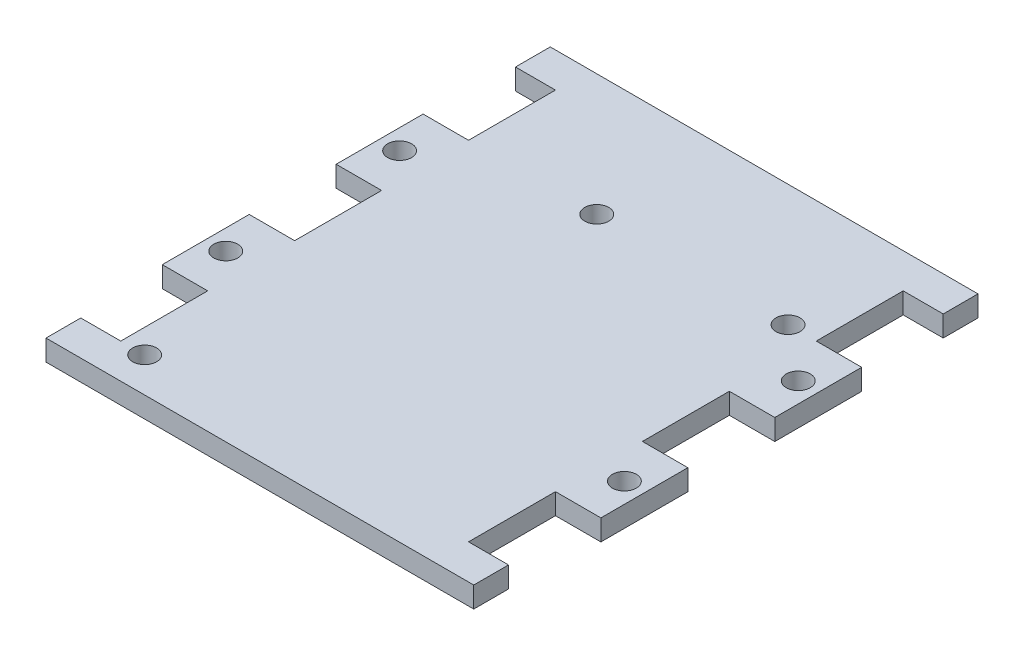
from build123d import *

# Parameters (mm, degrees)
SKETCH1_R           = 1.7526
BOSS_EXTRUDE1_DEPTH = 3.048
SKETCH2_R           = 1.7526
CUT_EXTRUDE1_DEPTH  = 49.908368221


with BuildPart() as part:
    # Sketch1 → Boss-Extrude1 (new body)
    with BuildSketch(Plane(origin=(0, 0, 0), x_dir=(1, 0, 0), z_dir=(0, 1, 0))):
        Polygon((31.242, -36.83), (-31.242, -36.83), (-31.242, -31.75), (-25.4, -31.75), (-25.4, -19.05), (-31.242, -19.05), (-32.03575, -19.05), (-32.03575, -6.35), (-31.242, -6.35), (-25.4, -6.35), (-25.4, 6.35), (-31.242, 6.35), (-32.03575, 6.35), (-32.03575, 19.05), (-31.242, 19.05), (-25.4, 19.05), (-25.4, 31.75), (-31.242, 31.75), (-31.242, 36.83), (31.242, 36.83), (31.242, 31.75), (25.4, 31.75), (25.4, 19.05), (31.242, 19.05), (32.03575, 19.05), (32.03575, 6.35), (31.242, 6.35), (25.4, 6.35), (25.4, -6.35), (31.242, -6.35), (32.03575, -6.35), (32.03575, -19.05), (31.242, -19.05), (25.4, -19.05), (25.4, -31.75), (31.242, -31.75), align=None)
        with Locations(Location((-29.11475, 12.7, 0), (0, 0, 90))):
            Circle(SKETCH1_R, mode=Mode.SUBTRACT)
        with Locations(Location((-29.11475, -12.7, 0), (0, 0, 90))):
            Circle(SKETCH1_R, mode=Mode.SUBTRACT)
        with Locations(Location((29.11475, -12.7, 0), (0, 0, 90))):
            Circle(SKETCH1_R, mode=Mode.SUBTRACT)
        with Locations(Location((29.11475, 12.7, 0), (0, 0, 90))):
            Circle(SKETCH1_R, mode=Mode.SUBTRACT)
    extrude(amount=BOSS_EXTRUDE1_DEPTH)

    # Sketch2 → Cut-Extrude1 (cut, through all)
    with BuildSketch(Plane(origin=(0, 3.048, 0), x_dir=(1, 0, 0), z_dir=(0, 1, 0))):
        with Locations(Location((21.2725, 19.05, 0), (0, 0, 270))):
            Circle(SKETCH2_R)
        with Locations(Location((-6.6675, 19.05, 0), (0, 0, 270))):
            Circle(SKETCH2_R)
        with Locations(Location((-21.9075, -31.75, 0), (0, 0, 270))):
            Circle(SKETCH2_R)
    extrude(amount=-CUT_EXTRUDE1_DEPTH, mode=Mode.SUBTRACT)


solid = part.part
